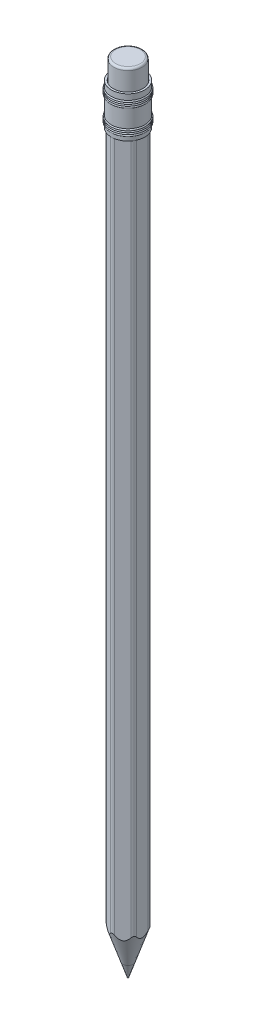
from build123d import *

# Parameters (mm, degrees)
SKETCH1_R      = 1.25
LEAD_DEPTH     = 185
SKETCH2_R      = 1.25
CASING_DEPTH   = 185
SKETCH3_R      = 3.5
ERASER_DEPTH   = 10
FILLET1_R      = 1
FILLET2_R      = 0.5
SKETCH5_W      = 1.740144231
SKETCH5_H      = 0.213701923
SKETCH5_W_2    = 2.442307692
TEXT_CUT_DEPTH = 0.25


with BuildPart() as part:
    # Sketch1 → Lead (new body)
    with BuildSketch(Plane(origin=(0, 0, 0), x_dir=(1, 0, 0), z_dir=(0, 1, 0))):
        with Locations(Location((0, 0, 0), (0, 0, 270))):
            Circle(SKETCH1_R)
    extrude(amount=LEAD_DEPTH)


with BuildPart() as body_2:
    # Sketch2 → Casing (new body)
    with BuildSketch(Plane.XZ):
        Polygon((0, 4.041451884), (-3.5, 2.020725942), (-3.5, -2.020725942), (0, -4.041451884), (3.5, -2.020725942), (3.5, 2.020725942), align=None)
        with Locations(Location((0, 0, 0), (0, 0, 270))):
            Circle(SKETCH2_R, mode=Mode.SUBTRACT)
    extrude(amount=-CASING_DEPTH)

    # Fillet1
    fillet1_edges = [body_2.edges().sort_by_distance(p)[0] for p in [
        (3.5, 92.5, -2.020725942),
        (0, 92.5, -4.041451884),
        (-3.5, 92.5, -2.020725942),
        (-3.5, 92.5, 2.020725942),
        (0, 92.5, 4.041451884),
        (3.5, 92.5, 2.020725942),
    ]]
    fillet(fillet1_edges, radius=FILLET1_R)

    # Sketch5 → Text Cut (cut)
    # profile 1 of 9: a face of its own
    with BuildSketch(Plane(origin=(1.75, 0, -3.031088913), x_dir=(-0.8660254037844388, 0, -0.4999999999999997), z_dir=(0.49999999999999983, 0, -0.8660254037844389))):
        with BuildLine():
            Line((-1.137874327, 150.288184856), (-1.137874327, 150.7551808))
            add(Edge.make_bspline(
                [(-1.137874327, 150.7551808), (-1.137839019, 150.787301077), (-1.137771367, 150.848844955), (-1.135720264, 150.937097519), (-1.132980675, 151.017250212), (-1.129182994, 151.089130203), (-1.124694957, 151.152958656), (-1.118400266, 151.208446747), (-1.111827814, 151.256030624), (-1.10514575, 151.284541976), (-1.102098335, 151.297544832)],
                knots=[0, 0, 0, 0, 1.415646017, 2.712440637, 3.8905458, 4.950247383, 5.884950622, 6.709939814, 7.411656543, 8, 8, 8, 8], degree=3))
            add(Edge.make_bspline(
                [(-1.102098335, 151.297544832), (-1.097592868, 151.314004932), (-1.0886881, 151.34653727), (-1.070855956, 151.393416665), (-1.049699514, 151.43800898), (-1.025633589, 151.480513245), (-0.997473543, 151.520155311), (-0.967092746, 151.558256669), (-0.932527862, 151.593472344), (-0.894869076, 151.626279326), (-0.85459402, 151.65660191), (-0.810970948, 151.682078363), (-0.765302244, 151.70435418), (-0.716967234, 151.722592522), (-0.66591899, 151.736155311), (-0.612520294, 151.746224315), (-0.556711101, 151.752644684), (-0.518569856, 151.753257507), (-0.499153624, 151.753569472)],
                knots=[0, 0, 0, 0, 0.999549623, 1.97554611, 2.93413192, 3.889860808, 4.833293765, 5.780583482, 6.742559327, 7.719844669, 8.705620613, 9.691528643, 10.674968152, 11.680406189, 12.713313868, 13.765869198, 14.862690416, 16, 16, 16, 16], degree=3))
            add(Edge.make_bspline(
                [(-0.499153624, 151.753569472), (-0.479574458, 151.753282752), (-0.441266497, 151.752721767), (-0.385223582, 151.745988758), (-0.331666963, 151.736919467), (-0.280715391, 151.722974151), (-0.232671447, 151.704709506), (-0.18680093, 151.683283663), (-0.143884225, 151.657441296), (-0.103765525, 151.627747225), (-0.066407174, 151.594714801), (-0.032079894, 151.558483784), (-0.000984621, 151.519200444), (0.026948355, 151.476989625), (0.051071288, 151.431439817), (0.072677598, 151.383241852), (0.090823444, 151.331976794), (0.100368897, 151.296501262), (0.105222127, 151.278464303)],
                knots=[0, 0, 0, 0, 1.121902311, 2.195077645, 3.232258892, 4.234102512, 5.217864754, 6.176164875, 7.132989551, 8.084763148, 9.034132444, 9.988522005, 10.94243251, 11.903244335, 12.886203696, 13.894208494, 14.929344452, 16, 16, 16, 16], degree=3))
            add(Edge.make_bspline(
                [(0.105222127, 151.278464303), (0.108392255, 151.263545715), (0.115339776, 151.230850762), (0.123148594, 151.177008822), (0.129552678, 151.114288995), (0.13552902, 151.042904682), (0.138695734, 150.962689416), (0.142413974, 150.873827172), (0.144168408, 150.776017212), (0.14427931, 150.707797814), (0.144337211, 150.672180499)],
                knots=[0, 0, 0, 0, 0.601372724, 1.317943291, 2.144091499, 3.08771165, 4.142394186, 5.309582461, 6.595334295, 8, 8, 8, 8], degree=3))
            Line((0.144337211, 150.672180499), (0.144337211, 150.501886779))
            Line((0.144337211, 150.501886779), (1.243375673, 150.501886779))
            Line((1.243375673, 150.501886779), (1.243375673, 150.288184856))
            Line((1.243375673, 150.288184856), (-1.137874327, 150.288184856))
        make_face()
        with BuildLine():
            Line((-0.893643558, 150.501886779), (-0.099893558, 150.501886779))
            Line((-0.099893558, 150.501886779), (-0.094646412, 150.918796335))
            add(Edge.make_bspline(
                [(-0.094646412, 150.918796335), (-0.094635203, 150.939152712), (-0.094613564, 150.978450279), (-0.097334148, 151.035214806), (-0.100432903, 151.087887229), (-0.105119591, 151.136269477), (-0.111263097, 151.180531314), (-0.11890316, 151.220290427), (-0.127209125, 151.256141477), (-0.141086331, 151.297381165), (-0.162423959, 151.343735933), (-0.193485638, 151.394374978), (-0.233724558, 151.43695865), (-0.278840896, 151.473740908), (-0.328895795, 151.503504523), (-0.382733258, 151.524501566), (-0.439555687, 151.537430679), (-0.478414398, 151.539045401), (-0.498199597, 151.539867549)],
                knots=[0, 0, 0, 0, 1.160746174, 2.240796558, 3.240300023, 4.169675897, 5.012224395, 5.787635701, 6.478238024, 7.109103438, 8.265591281, 9.382545711, 10.479929969, 11.588830844, 12.694575677, 13.785760505, 14.872603606, 16, 16, 16, 16], degree=3))
            add(Edge.make_bspline(
                [(-0.498199597, 151.539867549), (-0.517343817, 151.53900849), (-0.555400157, 151.537300786), (-0.611175268, 151.524608262), (-0.664402436, 151.503279054), (-0.714054236, 151.473714887), (-0.759071299, 151.437825277), (-0.798244052, 151.39614447), (-0.829524437, 151.348565831), (-0.85049177, 151.304675663), (-0.862767404, 151.265372558), (-0.871633646, 151.231402455), (-0.877747532, 151.192850361), (-0.883597758, 151.15008258), (-0.888320058, 151.103153411), (-0.891599403, 151.051764583), (-0.893498492, 150.996087227), (-0.893594032, 150.957435931), (-0.893643558, 150.93739985)],
                knots=[0, 0, 0, 0, 1.120540835, 2.227496496, 3.330685923, 4.466139262, 5.598993257, 6.692710361, 7.80064471, 8.921224235, 9.527843361, 10.209888745, 10.975318552, 11.811557897, 12.738105936, 13.73658638, 14.826690375, 16, 16, 16, 16], degree=3))
            Line((-0.893643558, 150.93739985), (-0.893643558, 150.501886779))
        make_face(mode=Mode.SUBTRACT)
    # profile 2 of 9: a face of its own
    with BuildSketch(Plane(origin=(1.75, 0, -3.031088913), x_dir=(-0.8660254037844388, 0, -0.4999999999999997), z_dir=(0.49999999999999983, 0, -0.8660254037844389))):
        with BuildLine():
            Line((0.693856442, 153.609150902), (0.793552205, 153.799002164))
            add(Edge.make_bspline(
                [(0.793552205, 153.799002164), (0.820381396, 153.783865401), (0.872580377, 153.754415254), (0.944299524, 153.703975669), (1.008435114, 153.650616301), (1.063960153, 153.592713637), (1.112995658, 153.532012529), (1.155291522, 153.467360073), (1.191610917, 153.39928399), (1.221371273, 153.327034453), (1.244767584, 153.250698012), (1.262045919, 153.169831708), (1.272065712, 153.084053721), (1.273281814, 153.025313071), (1.273904519, 152.995234886)],
                knots=[0, 0, 0, 0, 1.120611642, 2.180266485, 3.186550691, 4.152466804, 5.095166165, 6.022949561, 6.960161436, 7.899497276, 8.862391909, 9.862399089, 10.905440174, 12, 12, 12, 12], degree=3))
            add(Edge.make_bspline(
                [(1.273904519, 152.995234886), (1.27312403, 152.961800791), (1.271601522, 152.896580557), (1.258475757, 152.801643692), (1.237063312, 152.712258769), (1.207151045, 152.628430797), (1.168079941, 152.550365122), (1.120482561, 152.477906371), (1.064603091, 152.410674306), (0.99995875, 152.35078449), (0.930775829, 152.296877456), (0.858698379, 152.249277235), (0.783976012, 152.209667027), (0.70705331, 152.176954108), (0.628105073, 152.151149815), (0.546679154, 152.132812886), (0.46309843, 152.122340048), (0.406563739, 152.120728), (0.37807369, 152.119915626)],
                knots=[0, 0, 0, 0, 1.14524686, 2.234044844, 3.276713788, 4.290115724, 5.276966211, 6.260758605, 7.254862358, 8.264742877, 9.274005885, 10.257798278, 11.220590477, 12.167824544, 13.118936889, 14.062732937, 15.023735098, 16, 16, 16, 16], degree=3))
            add(Edge.make_bspline(
                [(0.37807369, 152.119915626), (0.351339171, 152.12063622), (0.298354886, 152.122064343), (0.219933149, 152.131066003), (0.143713792, 152.147019217), (0.06963348, 152.168910609), (-0.002183751, 152.197180296), (-0.071781608, 152.23176436), (-0.139086034, 152.272716674), (-0.181542452, 152.304334689), (-0.202928414, 152.320261178)],
                knots=[0, 0, 0, 0, 1.024358464, 2.0301432, 3.019427413, 4.004406732, 4.986367066, 5.972626655, 6.978780325, 8, 8, 8, 8], degree=3))
            add(Edge.make_bspline(
                [(-0.202928414, 152.320261178), (-0.228735489, 152.341796536), (-0.27944924, 152.384115891), (-0.345477781, 152.456435652), (-0.401959553, 152.533690055), (-0.448037494, 152.61665619), (-0.483478716, 152.705194302), (-0.508687589, 152.798847721), (-0.524373701, 152.897875301), (-0.526308019, 152.96575979), (-0.527297404, 153.000482032)],
                knots=[0, 0, 0, 0, 1.030811313, 2.025658015, 2.997072178, 3.962767568, 4.930766827, 5.917075773, 6.934604948, 8, 8, 8, 8], degree=3))
            add(Edge.make_bspline(
                [(-0.527297404, 153.000482032), (-0.526380781, 153.036167186), (-0.524582576, 153.106173325), (-0.507762683, 153.208219761), (-0.481413311, 153.304967843), (-0.443023527, 153.395619161), (-0.395436768, 153.481570517), (-0.335289332, 153.56084375), (-0.265670462, 153.635614962), (-0.21207478, 153.679091066), (-0.184801911, 153.701214454)],
                knots=[0, 0, 0, 0, 1.056389096, 2.072394598, 3.055233004, 4.020130009, 4.981825462, 5.957811105, 6.960805292, 8, 8, 8, 8], degree=3))
            add(Edge.make_bspline(
                [(-0.184801911, 153.701214454), (-0.164252689, 153.716268674), (-0.123291026, 153.74627691), (-0.056499578, 153.783864669), (0.013380309, 153.816492825), (0.087478207, 153.842572929), (0.164916171, 153.863690875), (0.246247796, 153.878969532), (0.33144886, 153.887929577), (0.389501392, 153.889690815), (0.419096827, 153.890588702)],
                knots=[0, 0, 0, 0, 0.94817472, 1.890038105, 2.849395472, 3.817997239, 4.812318967, 5.836947057, 6.897266129, 8, 8, 8, 8], degree=3))
            Line((0.419096827, 153.890588702), (0.419096827, 152.333617549))
            add(Edge.make_bspline(
                [(0.419096827, 152.333617549), (0.442025178, 152.334665031), (0.487112857, 152.336724862), (0.553087622, 152.346328201), (0.615934485, 152.361465313), (0.675182055, 152.382739443), (0.731604159, 152.408502422), (0.784782259, 152.440061276), (0.834474137, 152.477711936), (0.881124279, 152.519707457), (0.922667404, 152.56645282), (0.95985013, 152.615630903), (0.991014295, 152.667945989), (1.016309899, 152.722985578), (1.036112589, 152.780660668), (1.049629802, 152.840989429), (1.058683387, 152.903853148), (1.059690088, 152.946705942), (1.060202596, 152.968522146)],
                knots=[0, 0, 0, 0, 1.094153842, 2.151609401, 3.174256925, 4.172055639, 5.149267565, 6.128595816, 7.11444997, 8.118368179, 9.117203808, 10.09244225, 11.054858984, 12.015122123, 12.976791628, 13.957293641, 14.960065497, 16, 16, 16, 16], degree=3))
            add(Edge.make_bspline(
                [(1.060202596, 152.968522146), (1.059792232, 152.989853054), (1.05897799, 153.032177667), (1.050947027, 153.095192827), (1.038218649, 153.157296385), (1.019885912, 153.21787167), (0.998418524, 153.276035873), (0.973151548, 153.330196669), (0.944344335, 153.379638023), (0.911608545, 153.426027722), (0.871433134, 153.470779851), (0.821779838, 153.51587699), (0.762085486, 153.563165707), (0.717455298, 153.593245681), (0.693856442, 153.609150902)],
                knots=[0, 0, 0, 0, 0.991168677, 1.966668791, 2.94808785, 3.9350306, 4.905702032, 5.828266021, 6.709360349, 7.562606342, 8.463112863, 9.498839253, 10.677475166, 12, 12, 12, 12], degree=3))
        make_face()
        with BuildLine():
            add(Edge.make_bspline(
                [(0.205394904, 153.676886779), (0.177035105, 153.669096644), (0.122593505, 153.654142114), (0.047231392, 153.622293845), (-0.020131977, 153.587290797), (-0.078377173, 153.545154015), (-0.130189519, 153.497878162), (-0.174743777, 153.442516996), (-0.215808583, 153.381471592), (-0.25000579, 153.313526051), (-0.278107663, 153.241359806), (-0.298771226, 153.166456158), (-0.310917888, 153.089442494), (-0.312698754, 153.037571925), (-0.313595481, 153.011453336)],
                knots=[0, 0, 0, 0, 1.155085888, 2.217389643, 3.210301801, 4.133263417, 5.03575695, 5.95948047, 6.920061569, 7.923798377, 8.943125483, 9.960783337, 10.973185325, 12, 12, 12, 12], degree=3))
            add(Edge.make_bspline(
                [(-0.313595481, 153.011453336), (-0.313184179, 152.990122892), (-0.31237112, 152.947957088), (-0.304497221, 152.885863303), (-0.291844739, 152.826076692), (-0.273241213, 152.768775717), (-0.250604398, 152.713580279), (-0.222779172, 152.66053026), (-0.189137986, 152.610307629), (-0.163439661, 152.578918555), (-0.150456959, 152.563060908)],
                knots=[0, 0, 0, 0, 1.048823158, 2.073302879, 3.073550078, 4.050623576, 5.03253758, 6.005186856, 6.992227572, 8, 8, 8, 8], degree=3))
            add(Edge.make_bspline(
                [(-0.150456959, 152.563060908), (-0.140188513, 152.551701734), (-0.119407681, 152.528713536), (-0.083584177, 152.498029641), (-0.044932715, 152.468431799), (-0.00176612, 152.442129803), (0.044663821, 152.417133661), (0.094695897, 152.394355695), (0.148541294, 152.373644913), (0.186081164, 152.362018696), (0.205394904, 152.35603717)],
                knots=[0, 0, 0, 0, 0.879905587, 1.780714457, 2.708106151, 3.677566983, 4.684151534, 5.740052498, 6.837288539, 8, 8, 8, 8], degree=3))
            Line((0.205394904, 152.35603717), (0.205394904, 153.676886779))
        make_face(mode=Mode.SUBTRACT)
    # profile 3 of 9: a face of its own
    with BuildSketch(Plane(origin=(1.75, 0, -3.031088913), x_dir=(-0.8660254037844388, 0, -0.4999999999999997), z_dir=(0.49999999999999983, 0, -0.8660254037844389))):
        with BuildLine():
            Line((-0.496768558, 154.317992549), (-0.496768558, 154.531694472))
            Line((-0.496768558, 154.531694472), (-0.182893858, 154.531694472))
            add(Edge.make_bspline(
                [(-0.182893858, 154.531694472), (-0.21140442, 154.554472653), (-0.266643262, 154.598605082), (-0.338674165, 154.672856972), (-0.399119615, 154.750279602), (-0.446711715, 154.832130437), (-0.482705739, 154.917567215), (-0.508661672, 155.00634751), (-0.524234357, 155.098951848), (-0.526268396, 155.161929034), (-0.527297404, 155.193788823)],
                knots=[0, 0, 0, 0, 1.127869841, 2.185233117, 3.191641716, 4.159226741, 5.10472073, 6.052603964, 7.014823782, 8, 8, 8, 8], degree=3))
            add(Edge.make_bspline(
                [(-0.527297404, 155.193788823), (-0.526178901, 155.226006802), (-0.523988623, 155.289096769), (-0.504633698, 155.380609991), (-0.474183079, 155.466603539), (-0.430946531, 155.545809884), (-0.377550959, 155.61737935), (-0.315250785, 155.680009832), (-0.243966853, 155.732235051), (-0.177447333, 155.767142942), (-0.118335154, 155.789700682), (-0.067778884, 155.804528048), (-0.011429023, 155.81652274), (0.050573673, 155.827270769), (0.118478677, 155.834440806), (0.192123784, 155.84012442), (0.271496283, 155.844189744), (0.326391922, 155.844351463), (0.354700042, 155.844434856)],
                knots=[0, 0, 0, 0, 1.235846195, 2.420061613, 3.574938557, 4.72781258, 5.870749808, 6.993217613, 8.10690044, 9.251157787, 9.865716151, 10.534141144, 11.271861846, 12.076851687, 12.949307443, 13.892392281, 14.913166647, 16, 16, 16, 16], degree=3))
            Line((0.354700042, 155.844434856), (1.243375673, 155.844434856))
            Line((1.243375673, 155.844434856), (1.243375673, 155.630732933))
            Line((1.243375673, 155.630732933), (0.424820985, 155.630732933))
            add(Edge.make_bspline(
                [(0.424820985, 155.630732933), (0.401129252, 155.630602027), (0.355810999, 155.630351625), (0.290926444, 155.629551509), (0.232241933, 155.627668075), (0.179588812, 155.624912691), (0.133159794, 155.62105585), (0.092719865, 155.616927031), (0.058627233, 155.611919381), (0.03810423, 155.607453917), (0.028900012, 155.605451233)],
                knots=[0, 0, 0, 0, 1.430803381, 2.736883362, 3.918614142, 4.976458302, 5.92063272, 6.731858525, 7.431260095, 8, 8, 8, 8], degree=3))
            add(Edge.make_bspline(
                [(0.028900012, 155.605451233), (0.001862814, 155.59825796), (-0.050037031, 155.584449958), (-0.12031476, 155.549636072), (-0.180632712, 155.506693515), (-0.229750371, 155.453488673), (-0.267987204, 155.391450494), (-0.294497583, 155.320475847), (-0.311083842, 155.241299284), (-0.312734913, 155.18560871), (-0.313595481, 155.156581791)],
                knots=[0, 0, 0, 0, 1.084232, 2.08126119, 3.027460722, 3.945137793, 4.874029258, 5.839697328, 6.874011781, 8, 8, 8, 8], degree=3))
            add(Edge.make_bspline(
                [(-0.313595481, 155.156581791), (-0.313276286, 155.139389214), (-0.312644608, 155.105365549), (-0.306146422, 155.054939365), (-0.295873887, 155.005875943), (-0.280735061, 154.958286979), (-0.262153493, 154.912018024), (-0.239799225, 154.866744322), (-0.212280459, 154.823510661), (-0.181515853, 154.781605607), (-0.147449172, 154.742610478), (-0.111494721, 154.706328667), (-0.073207555, 154.673985703), (-0.0332025, 154.644683657), (0.009069316, 154.619389151), (0.053200216, 154.597309463), (0.099248248, 154.578575356), (0.131208067, 154.569266238), (0.147199291, 154.564608384)],
                knots=[0, 0, 0, 0, 1.023827899, 2.026128959, 3.023898047, 4.006668367, 4.997079741, 5.992687789, 7.009920206, 8.046337072, 9.087246971, 10.092051999, 11.086713115, 12.070168086, 13.043348831, 14.017773728, 15.008185103, 16, 16, 16, 16], degree=3))
            add(Edge.make_bspline(
                [(0.147199291, 154.564608384), (0.158938991, 154.561928016), (0.184495706, 154.556092995), (0.226435927, 154.549790724), (0.274952177, 154.54407057), (0.329987843, 154.539282925), (0.391735612, 154.536353704), (0.45993178, 154.533159838), (0.534848278, 154.531997066), (0.587005609, 154.531798161), (0.614195234, 154.531694472)],
                knots=[0, 0, 0, 0, 0.615963638, 1.340920617, 2.168419149, 3.115676021, 4.16674242, 5.331190069, 6.6087489, 8, 8, 8, 8], degree=3))
            Line((0.614195234, 154.531694472), (1.243375673, 154.531694472))
            Line((1.243375673, 154.531694472), (1.243375673, 154.317992549))
            Line((1.243375673, 154.317992549), (-0.496768558, 154.317992549))
        make_face()
    # profile 4 of 9: a face of its own
    with BuildSketch(Plane(origin=(1.75, 0, -3.031088913), x_dir=(-0.8660254037844388, 0, -0.4999999999999997), z_dir=(0.49999999999999983, 0, -0.8660254037844389))):
        with BuildLine():
            Line((-0.1194511, 158.042511779), (-0.008307019, 157.863631821))
            add(Edge.make_bspline(
                [(-0.008307019, 157.863631821), (-0.032683123, 157.844017217), (-0.080663344, 157.805409197), (-0.142582603, 157.738367324), (-0.195764108, 157.666922058), (-0.23910541, 157.589852529), (-0.272593575, 157.507266833), (-0.296290554, 157.419490658), (-0.311057191, 157.326536519), (-0.312735521, 157.262810732), (-0.313595481, 157.230158264)],
                knots=[0, 0, 0, 0, 1.026593902, 2.0206758, 2.988051866, 3.946915611, 4.916868779, 5.907761954, 6.927957743, 8, 8, 8, 8], degree=3))
            add(Edge.make_bspline(
                [(-0.313595481, 157.230158264), (-0.312876451, 157.204060473), (-0.31146034, 157.152661585), (-0.302608558, 157.077205791), (-0.286523549, 157.005331262), (-0.265329773, 156.936587494), (-0.236924665, 156.871463423), (-0.202355885, 156.809788423), (-0.162180768, 156.751015438), (-0.115637165, 156.69684762), (-0.0650195, 156.647297884), (-0.010758504, 156.604368088), (0.045520565, 156.566991353), (0.10522309, 156.537663907), (0.166983226, 156.513664193), (0.23196676, 156.497875335), (0.299341172, 156.487353819), (0.345277757, 156.486150044), (0.368533425, 156.485540626)],
                knots=[0, 0, 0, 0, 1.112346261, 2.190735716, 3.231507886, 4.247384806, 5.251966152, 6.253067467, 7.256802811, 8.280671706, 9.291813951, 10.270744147, 11.225547591, 12.165006084, 13.100104208, 14.043489273, 15.009504848, 16, 16, 16, 16], degree=3))
            add(Edge.make_bspline(
                [(0.368533425, 156.485540626), (0.398988125, 156.486769499), (0.459643018, 156.489216976), (0.549025458, 156.507831939), (0.635284113, 156.538979674), (0.717952654, 156.58105882), (0.794550237, 156.634471356), (0.863256816, 156.697176301), (0.922730463, 156.769240528), (0.972037793, 156.850020525), (1.011676295, 156.937621883), (1.039916115, 157.031096193), (1.056960673, 157.129679802), (1.059107842, 157.19717582), (1.060202596, 157.231589303)],
                knots=[0, 0, 0, 0, 0.96628757, 1.924499989, 2.884001032, 3.87047137, 4.860396324, 5.839257425, 6.814467993, 7.816059692, 8.834901047, 9.858382822, 10.908076205, 12, 12, 12, 12], degree=3))
            add(Edge.make_bspline(
                [(1.060202596, 157.231589303), (1.059318474, 157.263127384), (1.057580939, 157.325108082), (1.042933555, 157.415709396), (1.018955297, 157.501965014), (0.985517343, 157.58387187), (0.942295943, 157.661280297), (0.888983722, 157.733690147), (0.827114356, 157.802542248), (0.779273022, 157.843021441), (0.754914135, 157.863631821)],
                knots=[0, 0, 0, 0, 1.039848629, 2.043578496, 3.018386758, 3.987534228, 4.954977003, 5.934852016, 6.948509513, 8, 8, 8, 8], degree=3))
            Line((0.754914135, 157.863631821), (0.872259387, 158.042511779))
            add(Edge.make_bspline(
                [(0.872259387, 158.042511779), (0.887833256, 158.031906575), (0.918929304, 158.010731366), (0.962774319, 157.975333999), (1.003814606, 157.937152471), (1.041995154, 157.896335739), (1.078229628, 157.853416762), (1.110785788, 157.806929381), (1.141493587, 157.758372556), (1.169124845, 157.707176254), (1.193962182, 157.653869797), (1.215319389, 157.598528194), (1.233668693, 157.541391928), (1.248253745, 157.482393822), (1.259895226, 157.421417563), (1.267619798, 157.358620847), (1.273386016, 157.294025303), (1.273730186, 157.250365322), (1.273904519, 157.228250211)],
                knots=[0, 0, 0, 0, 0.954134338, 1.905101784, 2.851144739, 3.791306361, 4.734911809, 5.6936923, 6.663572882, 7.643865596, 8.638447847, 9.640600242, 10.646758161, 11.676244097, 12.717260333, 13.78922464, 14.880174919, 16, 16, 16, 16], degree=3))
            add(Edge.make_bspline(
                [(1.273904519, 157.228250211), (1.273297123, 157.194497533), (1.272106623, 157.12834204), (1.259052212, 157.031505676), (1.239299079, 156.938990428), (1.211188421, 156.850633715), (1.17406507, 156.766975715), (1.129757028, 156.687319974), (1.076800042, 156.612488485), (1.016452194, 156.542971819), (0.950954376, 156.479398852), (0.880685054, 156.424080372), (0.807196976, 156.377199688), (0.730026928, 156.338580913), (0.649491344, 156.308384634), (0.565098227, 156.287595571), (0.477563607, 156.274181762), (0.417874619, 156.272626949), (0.387613954, 156.271838702)],
                knots=[0, 0, 0, 0, 1.113096611, 2.181677437, 3.217994567, 4.231807234, 5.234933164, 6.233258928, 7.234764453, 8.254006763, 9.267004511, 10.242118657, 11.199842941, 12.138404996, 13.084707599, 14.031460992, 15.002005182, 16, 16, 16, 16], degree=3))
            add(Edge.make_bspline(
                [(0.387613954, 156.271838702), (0.367081841, 156.272138751), (0.326240078, 156.272735597), (0.265623613, 156.279581301), (0.205814406, 156.288424905), (0.147570583, 156.303410273), (0.09000877, 156.320718988), (0.033822767, 156.342813948), (-0.02124852, 156.368732422), (-0.075063225, 156.398159194), (-0.126736037, 156.431284929), (-0.175554155, 156.467943411), (-0.222104031, 156.506753933), (-0.26477859, 156.549532145), (-0.305284463, 156.594462695), (-0.342539544, 156.642816749), (-0.376653325, 156.694316962), (-0.408256605, 156.748189901), (-0.436395792, 156.804404214), (-0.46063912, 156.862620109), (-0.481357748, 156.922486795), (-0.497760423, 156.984100036), (-0.511515491, 157.047050879), (-0.520168169, 157.111835396), (-0.526282044, 157.178205748), (-0.526956137, 157.223147435), (-0.527297404, 157.2458997)],
                knots=[0, 0, 0, 0, 0.990994727, 1.971252077, 2.943264845, 3.907940874, 4.872158414, 5.844625996, 6.82015047, 7.809835459, 8.804511986, 9.781214284, 10.756496977, 11.728388426, 12.696359165, 13.676225489, 14.672885716, 15.677705647, 16.690706858, 17.706033469, 18.721040654, 19.747369689, 20.783475414, 21.830280724, 22.901553713, 24, 24, 24, 24], degree=3))
            add(Edge.make_bspline(
                [(-0.527297404, 157.2458997), (-0.526670254, 157.274393166), (-0.525419088, 157.331237675), (-0.514887112, 157.415561094), (-0.499013641, 157.498645016), (-0.475478308, 157.5790199), (-0.447044456, 157.655754186), (-0.414922242, 157.727392764), (-0.378410596, 157.79285375), (-0.337733055, 157.852714545), (-0.291394844, 157.906958563), (-0.239867627, 157.956976095), (-0.182780508, 158.003096686), (-0.14073512, 158.029264985), (-0.1194511, 158.042511779)],
                knots=[0, 0, 0, 0, 1.095139042, 2.184804066, 3.262657822, 4.34424993, 5.400369085, 6.407210964, 7.359649996, 8.278719237, 9.185177137, 10.097389079, 11.036869154, 12, 12, 12, 12], degree=3))
        make_face()
    # profile 5 of 9: a face of its own
    with BuildSketch(Plane(origin=(1.75, 0, -3.031088913), x_dir=(-0.8660254037844388, 0, -0.4999999999999997), z_dir=(0.49999999999999983, 0, -0.8660254037844389))):
        with BuildLine():
            add(Edge.make_bspline(
                [(-1.229460865, 158.545283714), (-1.228845719, 158.55854477), (-1.227641144, 158.584512465), (-1.217325925, 158.622063599), (-1.19984096, 158.656256316), (-1.176382463, 158.686585095), (-1.148794359, 158.712610039), (-1.116640022, 158.730830487), (-1.081901912, 158.742541063), (-1.057670932, 158.743955223), (-1.045333762, 158.744675241)],
                knots=[0, 0, 0, 0, 1.055194115, 2.066272739, 3.074728998, 4.095836921, 5.109056067, 6.073838105, 7.019297344, 8, 8, 8, 8], degree=3))
            add(Edge.make_bspline(
                [(-1.045333762, 158.744675241), (-1.03331685, 158.743938986), (-1.009560837, 158.742483496), (-0.975424956, 158.730839532), (-0.943717399, 158.71245476), (-0.916182863, 158.686601783), (-0.892737334, 158.656251894), (-0.875248931, 158.622064773), (-0.864934623, 158.584512156), (-0.863729922, 158.558544666), (-0.863114712, 158.545283714)],
                knots=[0, 0, 0, 0, 0.96129708, 1.900370562, 2.859976407, 3.87933698, 4.906634145, 5.921202961, 6.938410037, 8, 8, 8, 8], degree=3))
            add(Edge.make_bspline(
                [(-0.863114712, 158.545283714), (-0.863706432, 158.532174406), (-0.864858138, 158.506658849), (-0.875451311, 158.46966998), (-0.892743318, 158.435768811), (-0.916029348, 158.405380882), (-0.943886501, 158.380051054), (-0.975405606, 158.361614515), (-1.009565763, 158.349997443), (-1.033318505, 158.348538329), (-1.045333762, 158.347800241)],
                knots=[0, 0, 0, 0, 1.054934014, 2.053291228, 3.073705704, 4.106921865, 5.123545215, 6.088680038, 7.033164197, 8, 8, 8, 8], degree=3))
            add(Edge.make_bspline(
                [(-1.045333762, 158.347800241), (-1.057669215, 158.348522159), (-1.081896823, 158.349940051), (-1.116659694, 158.361623223), (-1.148623894, 158.379897485), (-1.176535886, 158.405397654), (-1.199835012, 158.435764348), (-1.217123555, 158.469671133), (-1.227717627, 158.506658545), (-1.228869209, 158.532174302), (-1.229460865, 158.545283714)],
                knots=[0, 0, 0, 0, 0.98631895, 1.937192651, 2.907499808, 3.917963147, 4.944918757, 5.95915025, 6.951458133, 8, 8, 8, 8], degree=3))
        make_face()
    # profile 6 of 9: a face of its own
    with BuildSketch(Plane(origin=(1.75, 0, -3.031088913), x_dir=(-0.8660254037844388, 0, -0.4999999999999997), z_dir=(0.49999999999999983, 0, -0.8660254037844389))):
        with Locations((0.373303557, 158.546237741)):
            Rectangle(SKETCH5_W, SKETCH5_H)
    # profile 7 of 9: a face of its own
    with BuildSketch(Plane(origin=(1.75, 0, -3.031088913), x_dir=(-0.8660254037844388, 0, -0.4999999999999997), z_dir=(0.49999999999999983, 0, -0.8660254037844389))):
        with Locations((0.022221827, 159.217872357)):
            Rectangle(SKETCH5_W_2, SKETCH5_H)
    # profile 8 of 9: a face of its own
    with BuildSketch(Plane(origin=(1.75, 0, -3.031088913), x_dir=(-0.8660254037844388, 0, -0.4999999999999997), z_dir=(0.49999999999999983, 0, -0.8660254037844389))):
        with BuildLine():
            Line((-0.405182019, 160.881694472), (-0.405182019, 160.667992549))
            add(Edge.make_bspline(
                [(-0.405182019, 160.667992549), (-0.433533105, 160.669385344), (-0.489213884, 160.672120756), (-0.570396756, 160.684930718), (-0.647994753, 160.703260136), (-0.72138482, 160.729175929), (-0.791215865, 160.761361093), (-0.857210519, 160.799957772), (-0.919117024, 160.845673588), (-0.976361487, 160.897521384), (-1.028876602, 160.953833619), (-1.074225973, 161.014593553), (-1.112542103, 161.078441687), (-1.144574162, 161.145184314), (-1.168617878, 161.215574447), (-1.186457958, 161.28897332), (-1.197191508, 161.365703411), (-1.198345248, 161.417982069), (-1.198932019, 161.444570073)],
                knots=[0, 0, 0, 0, 1.10065271, 2.161652631, 3.183658789, 4.190468796, 5.17591951, 6.163126047, 7.15150782, 8.156236427, 9.156009102, 10.134482811, 11.092018607, 12.041330605, 13.001268258, 13.972401359, 14.968799086, 16, 16, 16, 16], degree=3))
            add(Edge.make_bspline(
                [(-1.198932019, 161.444570073), (-1.198325709, 161.470682707), (-1.19713433, 161.521993101), (-1.186749241, 161.596848584), (-1.170835018, 161.668278667), (-1.147252647, 161.735473835), (-1.11766193, 161.799123697), (-1.080861996, 161.858440164), (-1.038594095, 161.914857569), (-0.988737033, 161.965607045), (-0.935539421, 162.01222656), (-0.87872482, 162.052409764), (-0.819976772, 162.087015855), (-0.758836371, 162.115339859), (-0.695104514, 162.136810715), (-0.629392219, 162.152718561), (-0.560941123, 162.161812345), (-0.514603008, 162.163200343), (-0.491044399, 162.16390601)],
                knots=[0, 0, 0, 0, 1.111674182, 2.184400057, 3.212814286, 4.223731311, 5.211378316, 6.196328225, 7.191884489, 8.207283132, 9.220262353, 10.201199469, 11.166417575, 12.120932471, 13.06540007, 14.026332106, 14.996573967, 16, 16, 16, 16], degree=3))
            add(Edge.make_bspline(
                [(-0.491044399, 162.16390601), (-0.457878476, 162.162753969), (-0.392128645, 162.160470102), (-0.295507609, 162.140934336), (-0.20189574, 162.110421682), (-0.126552258, 162.07368745), (-0.06584736, 162.036619447), (-0.01584127, 162.003249204), (0.037987677, 161.963961646), (0.095857351, 161.91909243), (0.157009901, 161.867868844), (0.222693003, 161.81162167), (0.291692131, 161.748898304), (0.338850167, 161.704914146), (0.36328628, 161.682122657)],
                knots=[0, 0, 0, 0, 1.184416499, 2.348048165, 3.509039915, 4.696071444, 5.333504901, 6.05069495, 6.844171097, 7.714965912, 8.667477798, 9.695072654, 10.805644396, 12, 12, 12, 12], degree=3))
            Line((0.36328628, 161.682122657), (0.999144904, 161.086333144))
            Line((0.999144904, 161.086333144), (0.999144904, 162.194434856))
            Line((0.999144904, 162.194434856), (1.243375673, 162.194434856))
            Line((1.243375673, 162.194434856), (1.243375673, 160.57640601))
            Line((1.243375673, 160.57640601), (0.257866358, 161.499903606))
            add(Edge.make_bspline(
                [(0.257866358, 161.499903606), (0.234395189, 161.522387972), (0.189311876, 161.565575837), (0.123492112, 161.626660055), (0.062430371, 161.681523367), (0.006242023, 161.730520914), (-0.045894812, 161.772589781), (-0.092291565, 161.809922496), (-0.134987004, 161.8398348), (-0.1844766, 161.87229831), (-0.244900694, 161.903740323), (-0.318742365, 161.930758908), (-0.3947568, 161.947233653), (-0.44612515, 161.949209978), (-0.47196387, 161.950204087)],
                knots=[0, 0, 0, 0, 1.329631726, 2.553950428, 3.673215718, 4.687767853, 5.603093632, 6.413772471, 7.123043292, 7.734684054, 8.834405432, 9.900288307, 10.943827018, 12, 12, 12, 12], degree=3))
            add(Edge.make_bspline(
                [(-0.47196387, 161.950204087), (-0.48821175, 161.949771555), (-0.520233202, 161.948919118), (-0.567181763, 161.941395935), (-0.612469609, 161.930026822), (-0.656236045, 161.913735495), (-0.698041033, 161.892231624), (-0.737935462, 161.866055985), (-0.776504204, 161.835854888), (-0.81266743, 161.800917685), (-0.845788036, 161.762537705), (-0.875127815, 161.721992331), (-0.899647282, 161.679095743), (-0.919747411, 161.634028802), (-0.935514947, 161.586917153), (-0.946440517, 161.537669674), (-0.953300206, 161.486422442), (-0.954228331, 161.451429296), (-0.95470125, 161.433598769)],
                knots=[0, 0, 0, 0, 0.991446411, 1.95395049, 2.89581595, 3.838931463, 4.798493298, 5.75982156, 6.748411868, 7.785213223, 8.824556874, 9.840280684, 10.836137867, 11.835679398, 12.848801643, 13.863922112, 14.911575587, 16, 16, 16, 16], degree=3))
            add(Edge.make_bspline(
                [(-0.95470125, 161.433598769), (-0.954233968, 161.414972153), (-0.953316304, 161.378392556), (-0.946365459, 161.324799605), (-0.935827974, 161.273321239), (-0.919092149, 161.22472556), (-0.899317939, 161.17796026), (-0.874196936, 161.134023704), (-0.845005773, 161.09218641), (-0.811157429, 161.053136521), (-0.773126368, 161.017471544), (-0.731213513, 160.985694565), (-0.685720604, 160.958112151), (-0.636834351, 160.93401314), (-0.584068031, 160.914451271), (-0.527620943, 160.899501037), (-0.467734804, 160.887671952), (-0.42637926, 160.883720059), (-0.405182019, 160.881694472)],
                knots=[0, 0, 0, 0, 1.030878251, 2.024474673, 2.987898669, 3.934362936, 4.864849709, 5.795128259, 6.730474222, 7.685293701, 8.650606017, 9.611896181, 10.591709709, 11.591680886, 12.625074257, 13.701333388, 14.821793024, 16, 16, 16, 16], degree=3))
        make_face()
    # profile 9 of 9: a face of its own
    with BuildSketch(Plane(origin=(1.75, 0, -3.031088913), x_dir=(-0.8660254037844388, 0, -0.4999999999999997), z_dir=(0.49999999999999983, 0, -0.8660254037844389))):
        with BuildLine():
            Line((-1.137874327, 162.621838702), (-1.137874327, 163.08644958))
            add(Edge.make_bspline(
                [(-1.137874327, 163.08644958), (-1.137756636, 163.109193242), (-1.137528523, 163.153276121), (-1.133908524, 163.217374117), (-1.129096078, 163.277431711), (-1.121023459, 163.333342776), (-1.112653218, 163.385471115), (-1.100367707, 163.433287516), (-1.086797914, 163.477192502), (-1.065918944, 163.529913404), (-1.033493642, 163.589732491), (-0.985403837, 163.654026816), (-0.927748045, 163.709915366), (-0.862044721, 163.757437201), (-0.78976362, 163.795574484), (-0.712459892, 163.822816075), (-0.63143408, 163.840317111), (-0.575883395, 163.842094357), (-0.547808972, 163.842992549)],
                knots=[0, 0, 0, 0, 1.00128172, 1.940733171, 2.826250472, 3.653024905, 4.427672124, 5.149348099, 5.824709082, 6.450061444, 7.643590664, 8.808605388, 9.972104426, 11.165284501, 12.367876273, 13.557044126, 14.765369432, 16, 16, 16, 16], degree=3))
            add(Edge.make_bspline(
                [(-0.547808972, 163.842992549), (-0.521512586, 163.842244421), (-0.469837708, 163.840774279), (-0.39438757, 163.826887529), (-0.322638899, 163.804847273), (-0.254653102, 163.77438675), (-0.19169574, 163.73514007), (-0.133961838, 163.688117032), (-0.083633419, 163.631619226), (-0.055507582, 163.589268281), (-0.041220932, 163.56775592)],
                knots=[0, 0, 0, 0, 1.044641374, 2.052818814, 3.038628718, 4.023282556, 5.005660861, 5.98021751, 6.974042014, 8, 8, 8, 8], degree=3))
            add(Edge.make_bspline(
                [(-0.041220932, 163.56775592), (-0.030831918, 163.594804599), (-0.01095516, 163.646555422), (0.024131767, 163.717813187), (0.062432502, 163.778982388), (0.103612633, 163.831257934), (0.148655085, 163.875730892), (0.197925807, 163.914247046), (0.251384464, 163.947545011), (0.308834578, 163.975881349), (0.369789118, 163.998139896), (0.433503584, 164.014499619), (0.499733728, 164.024176751), (0.54467883, 164.025496861), (0.567447939, 164.026165626)],
                knots=[0, 0, 0, 0, 1.272586185, 2.434772614, 3.483318042, 4.437947805, 5.351807173, 6.25737843, 7.180033415, 8.1141739, 9.066731021, 10.025721652, 10.999834114, 12, 12, 12, 12], degree=3))
            add(Edge.make_bspline(
                [(0.567447939, 164.026165626), (0.590693709, 164.025501167), (0.636430413, 164.024193825), (0.703617823, 164.014544305), (0.767831457, 163.998217163), (0.829457071, 163.975688916), (0.888365456, 163.946488559), (0.944343207, 163.910439082), (0.997506784, 163.86804655), (1.047950017, 163.820136136), (1.09410716, 163.766743727), (1.133786737, 163.707901857), (1.167905518, 163.645222505), (1.195683813, 163.577904376), (1.21711475, 163.506119318), (1.232046218, 163.429907278), (1.2421239, 163.349393764), (1.242951335, 163.294141725), (1.243375673, 163.265806551)],
                knots=[0, 0, 0, 0, 0.978680899, 1.925582087, 2.851223405, 3.764209995, 4.683484765, 5.614004905, 6.562443559, 7.542772147, 8.539900013, 9.527881485, 10.525548727, 11.540192123, 12.58875426, 13.674701727, 14.807505862, 16, 16, 16, 16], degree=3))
            Line((1.243375673, 163.265806551), (1.243375673, 162.621838702))
            Line((1.243375673, 162.621838702), (-1.137874327, 162.621838702))
        make_face()
        with BuildLine():
            Line((-0.893643558, 162.835540626), (-0.130422404, 162.835540626))
            Line((-0.130422404, 162.835540626), (-0.130422404, 162.979121605))
            add(Edge.make_bspline(
                [(-0.130422404, 162.979121605), (-0.130694494, 163.000109803), (-0.131220229, 163.04066328), (-0.132726211, 163.099391637), (-0.136943093, 163.153905268), (-0.14115877, 163.204110062), (-0.148013068, 163.249926997), (-0.156172058, 163.291254443), (-0.164800757, 163.328741407), (-0.179476581, 163.371969978), (-0.201158884, 163.42101219), (-0.234840716, 163.473259014), (-0.274926348, 163.5195327), (-0.321612264, 163.558139635), (-0.372461435, 163.590015425), (-0.427027454, 163.612345418), (-0.48421225, 163.62723216), (-0.52354549, 163.628597441), (-0.543515853, 163.629290626)],
                knots=[0, 0, 0, 0, 1.156917035, 2.235399477, 3.236897345, 4.169954739, 5.01148057, 5.788325709, 6.491867502, 7.129259015, 8.302032419, 9.437271567, 10.542795419, 11.662606952, 12.764338259, 13.836858145, 14.901724648, 16, 16, 16, 16], degree=3))
            add(Edge.make_bspline(
                [(-0.543515853, 163.629290626), (-0.556734048, 163.628938669), (-0.582662981, 163.628248269), (-0.620584179, 163.622388473), (-0.656216195, 163.612894048), (-0.689901008, 163.600036037), (-0.72080147, 163.582470087), (-0.750394083, 163.562108842), (-0.776906397, 163.536969995), (-0.801614815, 163.508560866), (-0.823728768, 163.476055755), (-0.84204675, 163.438754339), (-0.858648927, 163.397620917), (-0.870939026, 163.351539516), (-0.881746241, 163.301464959), (-0.888536487, 163.246719218), (-0.892906074, 163.187649205), (-0.893392247, 163.146721105), (-0.893643558, 163.125564664)],
                knots=[0, 0, 0, 0, 0.911708768, 1.788416306, 2.640049961, 3.452993646, 4.268229297, 5.087074648, 5.92553149, 6.781184137, 7.681934069, 8.628939405, 9.643570426, 10.73771997, 11.914765019, 13.176320755, 14.540391495, 16, 16, 16, 16], degree=3))
            Line((-0.893643558, 163.125564664), (-0.893643558, 162.835540626))
        make_face(mode=Mode.SUBTRACT)
        with BuildLine():
            Line((0.113808365, 162.835540626), (0.999144904, 162.835540626))
            Line((0.999144904, 162.835540626), (0.999144904, 163.139875061))
            add(Edge.make_bspline(
                [(0.999144904, 163.139875061), (0.998857858, 163.161657087), (0.998304615, 163.203639072), (0.997007144, 163.264301579), (0.992099011, 163.320379626), (0.98757128, 163.372050118), (0.979829055, 163.419175921), (0.972522407, 163.462119531), (0.961676211, 163.500175997), (0.946769389, 163.544710868), (0.92290542, 163.594490559), (0.888040385, 163.648890802), (0.845011549, 163.69632697), (0.796074398, 163.737046493), (0.743011593, 163.770650011), (0.686516828, 163.794763714), (0.627688819, 163.809748829), (0.587568656, 163.811556923), (0.567447939, 163.812463702)],
                knots=[0, 0, 0, 0, 1.160376723, 2.23647316, 3.230273494, 4.158083346, 4.997711197, 5.773399541, 6.476071462, 7.102777513, 8.27340052, 9.405620712, 10.53304798, 11.669441455, 12.787990954, 13.865552736, 14.929550474, 16, 16, 16, 16], degree=3))
            add(Edge.make_bspline(
                [(0.567447939, 163.812463702), (0.554865591, 163.812276428), (0.529903851, 163.8119049), (0.493225789, 163.806276345), (0.457678947, 163.798133609), (0.423115195, 163.787409392), (0.390115678, 163.772417514), (0.358553841, 163.754038728), (0.327793882, 163.733000943), (0.28840309, 163.700543619), (0.243581834, 163.652644889), (0.200241108, 163.584575449), (0.164723804, 163.507605427), (0.149708608, 163.451649359), (0.141952145, 163.422743901)],
                knots=[0, 0, 0, 0, 0.723302347, 1.434937762, 2.129609326, 2.821140842, 3.513216847, 4.209993937, 4.920569932, 5.655069131, 7.14393391, 8.6716197, 10.280644748, 12, 12, 12, 12], degree=3))
            add(Edge.make_bspline(
                [(0.141952145, 163.422743901), (0.139601454, 163.411158034), (0.134504671, 163.386037484), (0.129124609, 163.345074827), (0.124331452, 163.298309888), (0.120786004, 163.24563468), (0.11712123, 163.18698256), (0.115696004, 163.122228263), (0.113995614, 163.051636233), (0.113872378, 163.002655708), (0.113808365, 162.977213552)],
                knots=[0, 0, 0, 0, 0.634451884, 1.375622551, 2.216452059, 3.157844607, 4.20941857, 5.370758133, 6.634282058, 8, 8, 8, 8], degree=3))
            Line((0.113808365, 162.977213552), (0.113808365, 162.835540626))
        make_face(mode=Mode.SUBTRACT)
    extrude(amount=-TEXT_CUT_DEPTH, mode=Mode.SUBTRACT)


with BuildPart() as body_3:
    # Sketch3 → Eraser (new body)
    with BuildSketch(Plane(origin=(0, 185, 0), x_dir=(1, 0, 0), z_dir=(0, 1, 0))):
        with Locations(Location((0, 0, 0), (0, 0, 270))):
            Circle(SKETCH3_R)
    extrude(amount=ERASER_DEPTH)

    # Fillet2
    fillet2_edges = [body_3.edges().sort_by_distance(p)[0] for p in [
        (0, 195, -3.5),
    ]]
    fillet(fillet2_edges, radius=FILLET2_R)


with BuildPart() as body_4:
    # Sketch4 → Ferrule Revolve (revolve)
    with BuildSketch(Plane(origin=(0, 0, 0), x_dir=(0, 0, -1), z_dir=(1, 0, 0)), mode=Mode.PRIVATE) as ferrule_revolve_sk:
        with BuildLine():
            Line((-3.6, 180), (-4.1, 180))
            Line((-4.1, 180), (-4.1, 181))
            ThreePointArc((-4.1, 181), (-4.3, 181.2), (-4.1, 181.4))
            ThreePointArc((-4.1, 181.4), (-4.3, 181.6), (-4.1, 181.8))
            ThreePointArc((-4.1, 181.8), (-4.3, 182), (-4.1, 182.2))
            ThreePointArc((-4.1, 182.2), (-4.3, 182.4), (-4.1, 182.6))
            Line((-4.1, 182.6), (-4.1, 187))
            ThreePointArc((-4.1, 187), (-4.3, 187.2), (-4.1, 187.4))
            ThreePointArc((-4.1, 187.4), (-4.3, 187.6), (-4.1, 187.8))
            ThreePointArc((-4.1, 187.8), (-4.3, 188), (-4.1, 188.2))
            ThreePointArc((-4.1, 188.2), (-4.3, 188.4), (-4.1, 188.6))
            Line((-4.1, 188.6), (-4.1, 190))
            Line((-4.1, 190), (-3.6, 190))
            Line((-3.6, 190), (-3.6, 188.6))
            ThreePointArc((-3.6, 188.6), (-3.4, 188.4), (-3.6, 188.2))
            ThreePointArc((-3.6, 188.2), (-3.4, 188), (-3.6, 187.8))
            ThreePointArc((-3.6, 187.8), (-3.4, 187.6), (-3.6, 187.4))
            ThreePointArc((-3.6, 187.4), (-3.4, 187.2), (-3.6, 187))
            Line((-3.6, 187), (-3.6, 182.6))
            ThreePointArc((-3.6, 182.6), (-3.4, 182.4), (-3.6, 182.2))
            ThreePointArc((-3.6, 182.2), (-3.4, 182), (-3.6, 181.8))
            ThreePointArc((-3.6, 181.8), (-3.4, 181.6), (-3.6, 181.4))
            ThreePointArc((-3.6, 181.4), (-3.4, 181.2), (-3.6, 181))
            Line((-3.6, 181), (-3.6, 180))
        make_face()
    revolve(ferrule_revolve_sk.sketch.rotate(Axis((0, 185, 0), (0, 1, 0)), 180), axis=Axis((0, 185, 0), (0, 1, 0)))


with BuildPart() as cut_revolve4_tool:
    # Sketch6 → Cut-Revolve4 (revolve)
    with BuildSketch(Plane.XY):
        Polygon((-4.1, 0), (-0.1, 0), (-4.1, 12), align=None)
    revolve(axis=Axis((0, 0, 0), (0, 1, 0)))


with BuildPart() as part_1:
    add(part.part)

    # Cut-Revolve4: cut by cut_revolve4_tool
    add(cut_revolve4_tool.part, mode=Mode.SUBTRACT)


with BuildPart() as body_2_1:
    add(body_2.part)

    # Cut-Revolve4: cut by cut_revolve4_tool
    add(cut_revolve4_tool.part, mode=Mode.SUBTRACT)


solid = Compound([body_3.part, body_4.part, part_1.part, body_2_1.part])
